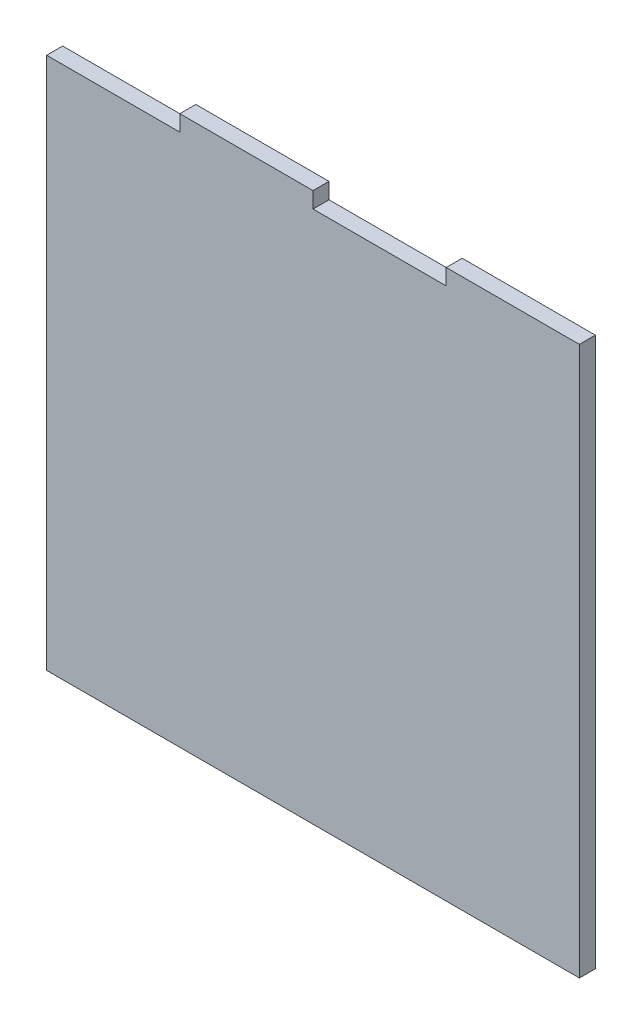
from build123d import *

# Parameters (mm, degrees)
BOSS_EXTRU_1_DEPTH = 6


with BuildPart() as part:
    # Esquisse1 → Boss.-Extru.1 (new body)
    with BuildSketch(Plane.XY):
        Polygon((0, 0), (50, 0), (50, 6), (100, 6), (100, 0), (150, 0), (150, 6), (200, 6), (200, 0), (200, -200), (0, -200), align=None)
    extrude(amount=BOSS_EXTRU_1_DEPTH)


solid = part.part
